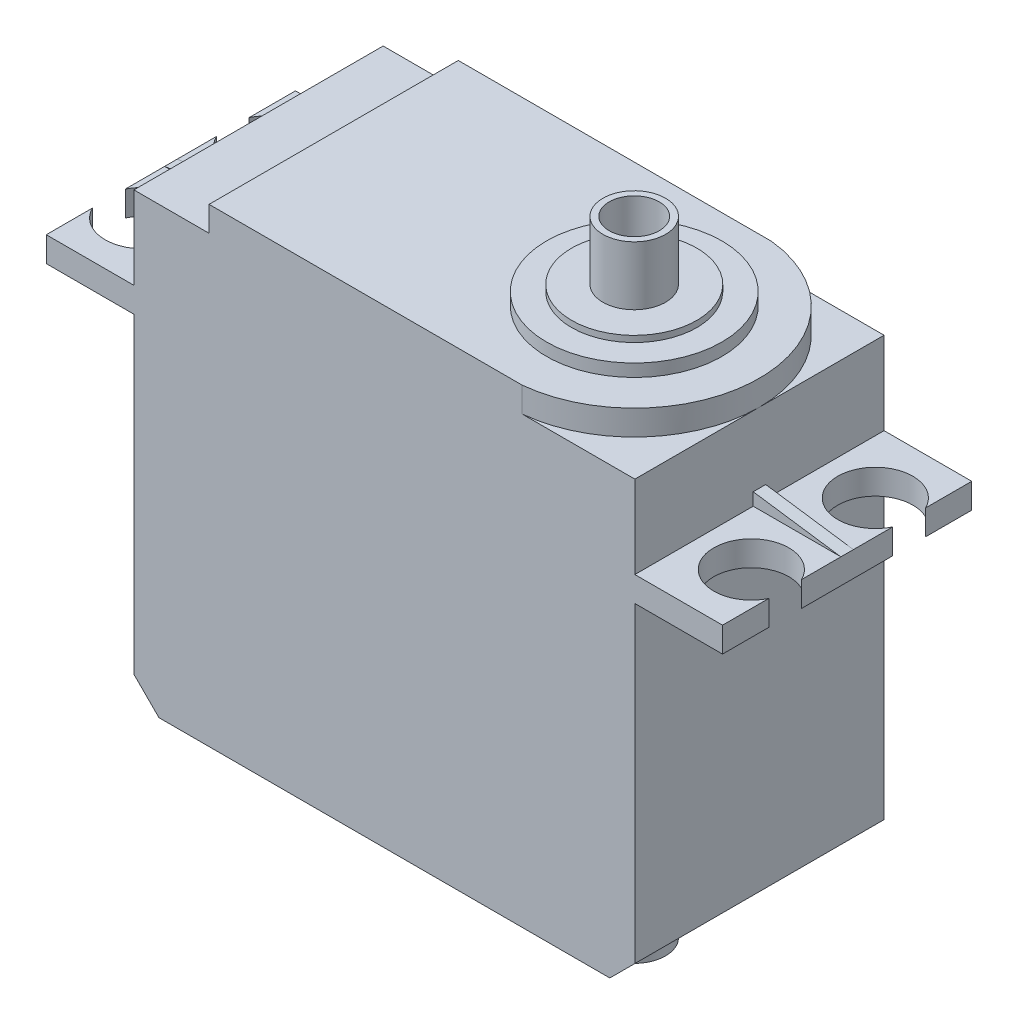
from build123d import *

# Parameters (mm, degrees)
SKETCH_2_W          = 40
SKETCH_2_H          = 37.5
EXTRUDE_1_DEPTH     = 9.95
SKETCH_3_W          = 7
SKETCH_3_H          = 2
EXTRUDE_2_DEPTH     = 19.9
EXTRUDE_2_2_DEPTH   = 19.9
SKETCH_4_R          = 3
CUT_EXTRUDE_1_DEPTH = 19.9
SKETCH_5_W          = 7
SKETCH_5_H          = 1
EXTRUDE_3_DEPTH     = 1
CUT_EXTRUDE_2_DEPTH = 35.492970298
CUT_EXTRUDE_6_DEPTH = 2
CUT_EXTRUDE_7_DEPTH = 2
SKETCH_10_R         = 2.5
SKETCH_10_R_2       = 2
EXTRUDE_4_DEPTH     = 6.2
SKETCH_11_R         = 7
EXTRUDE_5_DEPTH     = 1
SKETCH_12_R         = 5
EXTRUDE_6_DEPTH     = 0.5
EXTRUDE_START       = 6.2
SKETCH_13_R         = 2.5
SKETCH_13_R_2       = 2
EXTRUDE_7_DEPTH     = 6.2
CHAMFER_1_SIZE      = 2


with BuildPart() as part:
    # 草图2 → 凸台-拉伸1 (new, symmetric)
    with BuildSketch(Plane.XY):
        Rectangle(SKETCH_2_W, SKETCH_2_H)
    extrude(amount=EXTRUDE_1_DEPTH, both=True)



with BuildPart() as body_2:
    # 草图3 → 凸台-拉伸2 (new body)
    with BuildSketch(Plane.XY.offset(9.95)):
        with Locations((23.5, 9.15)):
            Rectangle(SKETCH_3_W, SKETCH_3_H)
    extrude(amount=-EXTRUDE_2_DEPTH)


with BuildPart() as body_3:
    # 草图3 → Extrude 2 2 (new body)
    with BuildSketch(Plane.XY.offset(9.95)):
        with Locations((-23.5, 9.15)):
            Rectangle(SKETCH_3_W, SKETCH_3_H)
    extrude(amount=-EXTRUDE_2_2_DEPTH)


with BuildPart() as cut_extrude_1_tool:
    # 草图4 → 切除-拉伸1 (new body)
    with BuildSketch(Plane(origin=(0, 10.15, 0), x_dir=(1, 0, 0), z_dir=(0, 1, 0))):
        with Locations((-24.3, 4.95)):
            Circle(SKETCH_4_R)
        with Locations((24.3, 4.95)):
            Circle(SKETCH_4_R)
        with Locations((24.3, -4.95)):
            Circle(SKETCH_4_R)
        with Locations((-24.3, -4.95)):
            Circle(SKETCH_4_R)
    extrude(amount=-CUT_EXTRUDE_1_DEPTH)


with BuildPart() as body_2_1:
    add(body_2.part)

    # 切除-拉伸1: cut by cut_extrude_1_tool
    add(cut_extrude_1_tool.part, mode=Mode.SUBTRACT)


with BuildPart() as body_3_1:
    add(body_3.part)

    # 切除-拉伸1: cut by cut_extrude_1_tool
    add(cut_extrude_1_tool.part, mode=Mode.SUBTRACT)


with BuildPart() as part_1:
    add(part.part)

    add(body_2_1.part)  # 凸台-拉伸3 merges body 2

    add(body_3_1.part)  # 凸台-拉伸3 merges body 3
    # 草图5 → 凸台-拉伸3 (add)
    with BuildSketch(Plane(origin=(0, 10.15, 0), x_dir=(1, 0, 0), z_dir=(0, 1, 0))):
        Polygon((-27, 0), (-27, 0.5), (-20, 0.5), (-20, -0.5), (-27, -0.5), align=None)
        with Locations((23.5, 0)):
            Rectangle(SKETCH_5_W, SKETCH_5_H)
    extrude(amount=EXTRUDE_3_DEPTH)

    # 草图6 → 切除-拉伸2 (cut, through all)
    with BuildSketch(Plane.XY.offset(0.5)):
        Polygon((20, 11.15), (27, 10.15), (27, 11.15), align=None)
        Polygon((-27, 10.15), (-27, 11.15), (-20, 11.15), align=None)
    extrude(amount=-CUT_EXTRUDE_2_DEPTH, mode=Mode.SUBTRACT)

    # 草图8 → 切除-拉伸6 (cut)
    with BuildSketch(Plane(origin=(0, 18.75, 0), x_dir=(1, 0, 0), z_dir=(0, 1, 0))):
        Polygon((-20, 9.95), (-20, -9.95), (-14, -9.95), (-14, -9.85), (-14, 9.85), (-14, 9.95), align=None)
    extrude(amount=-CUT_EXTRUDE_6_DEPTH, mode=Mode.SUBTRACT)

    # 草图9 → 切除-拉伸7 (cut)
    with BuildSketch(Plane(origin=(0, 18.75, 0), x_dir=(1, 0, 0), z_dir=(0, 1, 0))):
        with BuildLine():
            Line((20, 1.9e-08), (20, 9.95))
            Line((20, 9.95), (10.998749218, 9.95))
            ThreePointArc((10.998749218, 9.95), (17.41577683, 6.708670062), (20, 1.9e-08))
        make_face()
        with BuildLine():
            Line((20, -9.95), (20, 1.9e-08))
            ThreePointArc((20, 1.9e-08), (17.415776843, -6.708670048), (10.998749218, -9.95))
            Line((10.998749218, -9.95), (20, -9.95))
        make_face()
    extrude(amount=-CUT_EXTRUDE_7_DEPTH, mode=Mode.SUBTRACT)

    # 草图10 → 凸台-拉伸4 (add)
    with BuildSketch(Plane(origin=(0, 18.75, 0), x_dir=(1, 0, 0), z_dir=(0, 1, 0))):
        with Locations(Location((10, 0, 0), (0, 0, 90))):
            Circle(SKETCH_10_R)
        with Locations(Location((10, 0, 0), (0, 0, 90))):
            Circle(SKETCH_10_R_2, mode=Mode.SUBTRACT)
    extrude(amount=EXTRUDE_4_DEPTH)

    # 草图11 → 凸台-拉伸5 (add)
    with BuildSketch(Plane(origin=(0, 18.75, 0), x_dir=(1, 0, 0), z_dir=(0, 1, 0))):
        with Locations(Location((10, 0, 0), (0, 0, 90))):
            Circle(SKETCH_11_R)
    extrude(amount=EXTRUDE_5_DEPTH)

    # 草图12 → 凸台-拉伸6 (add)
    with BuildSketch(Plane(origin=(0, 19.75, 0), x_dir=(1, 0, 0), z_dir=(0, 1, 0))):
        with Locations(Location((10, 0, 0), (0, 0, 270))):
            Circle(SKETCH_12_R)
    extrude(amount=EXTRUDE_6_DEPTH)

    # 草图13 → 凸台-拉伸7 (add)
    with BuildSketch(Plane.XZ.offset(18.75).offset(EXTRUDE_START)):
        with Locations(Location((10, 0, 0), (0, 0, 270))):
            Circle(SKETCH_13_R)
        with Locations(Location((10, 0, 0), (0, 0, 270))):
            Circle(SKETCH_13_R_2, mode=Mode.SUBTRACT)
    extrude(amount=-EXTRUDE_7_DEPTH)

    # 倒角1
    chamfer_1_edges = [part_1.edges().sort_by_distance(p)[0] for p in [
        (20, -18.75, 0),
        (-20, -18.75, 0),
    ]]
    chamfer(chamfer_1_edges, length=CHAMFER_1_SIZE)


solid = part_1.part
